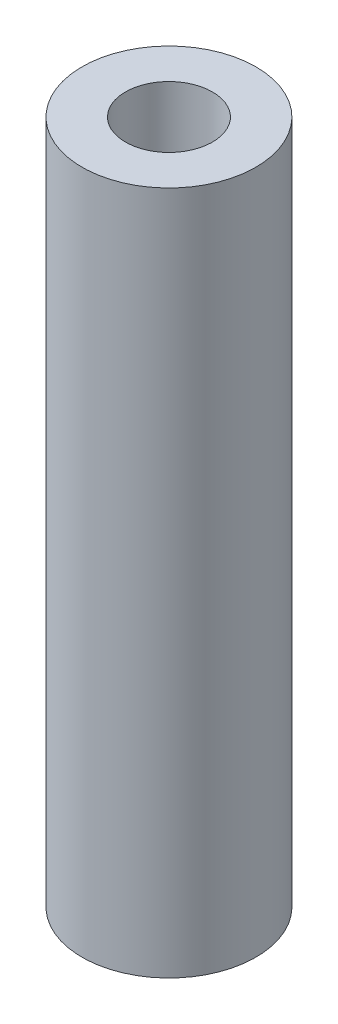
from build123d import *

# Parameters (mm, degrees)
SKETCH1_R           = 6.35
SKETCH1_R_2         = 3.175
BOSS_EXTRUDE1_DEPTH = 49.9618


with BuildPart() as part:
    # Sketch1 → Boss-Extrude1 (new body)
    with BuildSketch(Plane(origin=(0, 0, 0), x_dir=(1, 0, 0), z_dir=(0, 1, 0))):
        with Locations(Location((-32.524838495, 24.538829043, 0), (0, 0, 90))):
            Circle(SKETCH1_R)
        with Locations(Location((-32.524838495, 24.538829043, 0), (0, 0, 90))):
            Circle(SKETCH1_R_2, mode=Mode.SUBTRACT)
    extrude(amount=BOSS_EXTRUDE1_DEPTH)


solid = part.part
